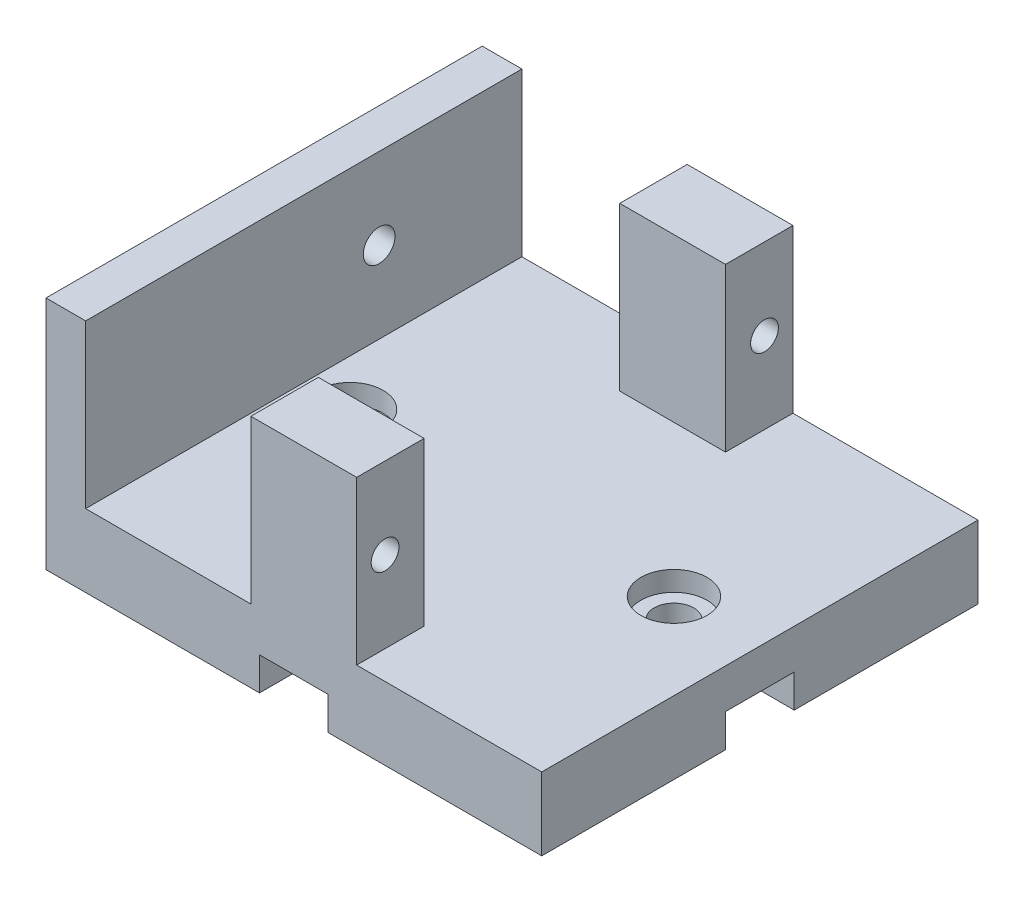
from build123d import *

# Parameters (mm, degrees)
AUFSATZ_LINEAR_AUSTRAGEN1_DEPTH      = 2.5
AUFSATZ_LINEAR_AUSTRAGEN1_DEPTH_BACK = 3
SKIZZE1_W                            = 37.5
SKIZZE1_H                            = 33
SKIZZE2_W                            = 3
SKIZZE2_H                            = 33
SKIZZE2_W_2                          = 8
SKIZZE2_H_2                          = 5.1
AUFSATZ_LINEAR_AUSTRAGEN2_DEPTH      = 12.3
SKIZZE5_R                            = 1.2
SCHNITT_LINEAR_AUSTRAGEN4_DEPTH      = 42.006584837
SKIZZE7_R                            = 1.05
SCHNITT_LINEAR_AUSTRAGEN5_DEPTH      = 10
SKIZZE8_W                            = 5.2
SKIZZE8_H                            = 13
SKIZZE8_W_2                          = 13
SKIZZE8_H_2                          = 5.2
SCHNITT_LINEAR_AUSTRAGEN6_DEPTH      = 2.5
SCHNITT_LINEAR_AUSTRAGEN7_DEPTH      = 30.031922086
SCHNITT_LINEAR_AUSTRAGEN7_DEPTH_BACK = 30.031922086
SKIZZE10_R                           = 1.5
SKIZZE13_R                           = 2.5
SCHNITT_LINEAR_AUSTRAGEN8_DEPTH      = 1.5


with BuildPart() as part:
    # Skizze1 → Aufsatz-Linear austragen1 (new, two sides: drawn at the far end of the back side and taken through both)
    with BuildSketch(Plane(origin=(0, 0, 0), x_dir=(1, 0, 0), z_dir=(0, 1, 0)).offset(-AUFSATZ_LINEAR_AUSTRAGEN1_DEPTH_BACK)):
        Rectangle(SKIZZE1_W, SKIZZE1_H)
    extrude(amount=AUFSATZ_LINEAR_AUSTRAGEN1_DEPTH + AUFSATZ_LINEAR_AUSTRAGEN1_DEPTH_BACK)

    # Skizze2 → Aufsatz-Linear austragen2 (add)
    with BuildSketch(Plane(origin=(0, 2.5, 0), x_dir=(1, 0, 0), z_dir=(0, 1, 0))):
        with Locations((-17.25, 0)):
            Rectangle(SKIZZE2_W, SKIZZE2_H)
        with Locations((0.75, -13.95)):
            Rectangle(SKIZZE2_W_2, SKIZZE2_H_2)
        with Locations((0.75, 13.95)):
            Rectangle(SKIZZE2_W_2, SKIZZE2_H_2)
    extrude(amount=AUFSATZ_LINEAR_AUSTRAGEN2_DEPTH)

    # Skizze5 → Schnitt-Linear austragen4 (cut, through all)
    with BuildSketch(Plane(origin=(-15.75, 0, 0), x_dir=(0, 0, -1), z_dir=(1, 0, 0))):
        with Locations((5.7, 8.65)):
            Circle(SKIZZE5_R)
    extrude(amount=-SCHNITT_LINEAR_AUSTRAGEN4_DEPTH, mode=Mode.SUBTRACT)

    # Skizze7 → Schnitt-Linear austragen5 (cut)
    with BuildSketch(Plane(origin=(4.75, 0, 0), x_dir=(0, 0, -1), z_dir=(1, 0, 0))):
        with Locations((-14.35, 8.65)):
            Circle(SKIZZE7_R)
        with Locations((14.35, 8.65)):
            Circle(SKIZZE7_R)
    extrude(amount=-SCHNITT_LINEAR_AUSTRAGEN5_DEPTH, mode=Mode.SUBTRACT)

    # Skizze8 → Schnitt-Linear austragen6 (cut)
    with BuildSketch(Plane.XZ.offset(3)):
        with Locations((5.277e-06, -12.250005277)):
            Rectangle(SKIZZE8_W, SKIZZE8_H)
        with Locations((12.25, 0)):
            Rectangle(SKIZZE8_W_2, SKIZZE8_H_2)
        with Locations((-12.25, -1.0555e-05)):
            Rectangle(SKIZZE8_W_2, SKIZZE8_H_2)
        with Locations((-5.277e-06, 12.249994723)):
            Rectangle(SKIZZE8_W, SKIZZE8_H)
    extrude(amount=-SCHNITT_LINEAR_AUSTRAGEN6_DEPTH, mode=Mode.SUBTRACT)

    # Skizze10 → Schnitt-Linear austragen7 (cut, two sides: drawn at the far end of the back side and taken through both)
    with BuildSketch(Plane(origin=(0, 0, 0), x_dir=(-1, 0, 0), z_dir=(0, 1, 0)).offset(-SCHNITT_LINEAR_AUSTRAGEN7_DEPTH_BACK)):
        with Locations(Location((-12.25, 0, 0), (0, 0, 90))):
            Circle(SKIZZE10_R)
        with Locations(Location((12.25, 0, 0), (0, 0, 270))):
            Circle(SKIZZE10_R)
    extrude(amount=SCHNITT_LINEAR_AUSTRAGEN7_DEPTH + SCHNITT_LINEAR_AUSTRAGEN7_DEPTH_BACK, mode=Mode.SUBTRACT)

    # Skizze13 → Schnitt-Linear austragen8 (cut)
    with BuildSketch(Plane(origin=(0, 2.5, 0), x_dir=(-1, 0, 0), z_dir=(0, 1, 0))):
        with Locations(Location((12.25, 0, 0), (0, 0, 90))):
            Circle(SKIZZE13_R)
        with Locations(Location((-12.25, 0, 0), (0, 0, 270))):
            Circle(SKIZZE13_R)
    extrude(amount=-SCHNITT_LINEAR_AUSTRAGEN8_DEPTH, mode=Mode.SUBTRACT)


solid = part.part
